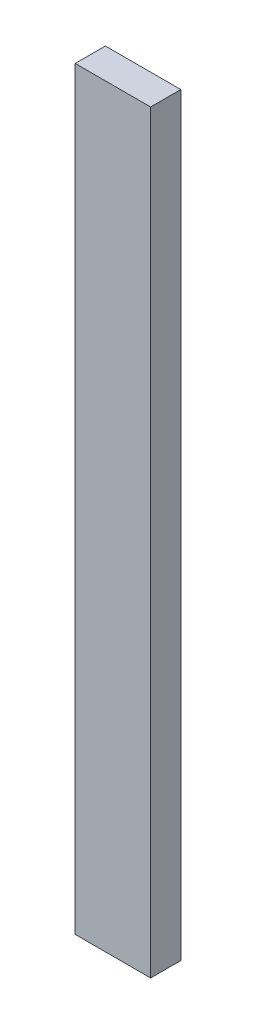
from build123d import *

# Parameters (mm, degrees)
SKETCH1_W           = 5
SKETCH1_H           = 50
BOSS_EXTRUDE1_DEPTH = 2


with BuildPart() as part:
    # Sketch1 → Boss-Extrude1 (new body)
    with BuildSketch(Plane.XY):
        Rectangle(SKETCH1_W, SKETCH1_H)
    extrude(amount=BOSS_EXTRUDE1_DEPTH)


solid = part.part
